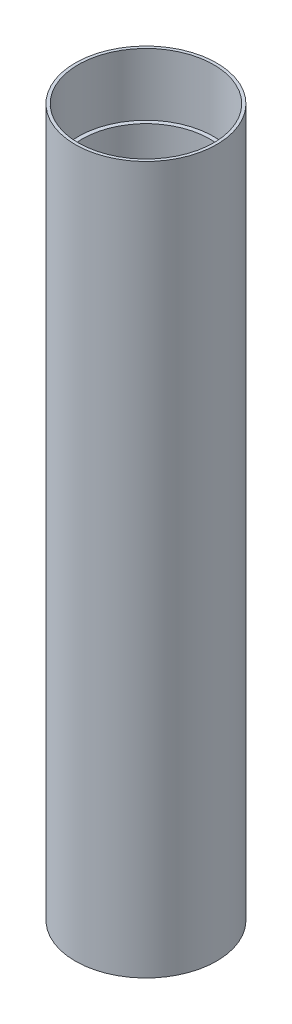
from build123d import *

# Parameters (mm, degrees)
SKETCH_1_R          = 25
SKETCH_1_R_2        = 22.5
EXTRUDE_1_DEPTH     = 250
SKETCH_2_R          = 24
CUT_EXTRUDE_1_DEPTH = 22
CUT_EXTRUDE_START   = -22
SKETCH_3_R          = 24
CUT_EXTRUDE_2_DEPTH = 22
SKETCH_4_R          = 24
SKETCH_4_R_2        = 23.95
EXTRUDE_2_DEPTH     = 22


with BuildPart() as part:
    # Эскиз1 → Бобышка-Вытянуть1 (new body)
    with BuildSketch(Plane(origin=(0, 0, 0), x_dir=(1, 0, 0), z_dir=(0, 1, 0))):
        with Locations(Location((0, 0, 0), (0, 0, 270))):
            Circle(SKETCH_1_R)
        with Locations(Location((0, 0, 0), (0, 0, 270))):
            Circle(SKETCH_1_R_2, mode=Mode.SUBTRACT)
    extrude(amount=EXTRUDE_1_DEPTH)

    # Эскиз2 → Вырез-Вытянуть1 (cut)
    with BuildSketch(Plane.XZ):
        with Locations(Location((0, 0, 0), (0, 0, 270))):
            Circle(SKETCH_2_R)
    extrude(amount=-CUT_EXTRUDE_1_DEPTH, mode=Mode.SUBTRACT)

    # Эскиз3 → Вырез-Вытянуть2 (cut)
    with BuildSketch(Plane(origin=(0, 250, 0), x_dir=(1, 0, 0), z_dir=(0, 1, 0)).offset(CUT_EXTRUDE_START)):
        with Locations(Location((0, 0, 0), (0, 0, 90))):
            Circle(SKETCH_3_R)
    extrude(amount=CUT_EXTRUDE_2_DEPTH, mode=Mode.SUBTRACT)

    # Эскиз4 → Бобышка-Вытянуть2 (add)
    with BuildSketch(Plane(origin=(0, 228, 0), x_dir=(1, 0, 0), z_dir=(0, 1, 0))):
        with Locations(Location((0, 0, 0), (0, 0, 90))):
            Circle(SKETCH_4_R)
        with Locations(Location((0, 0, 0), (0, 0, 270))):
            Circle(SKETCH_4_R_2, mode=Mode.SUBTRACT)
    extrude(amount=EXTRUDE_2_DEPTH)


solid = part.part
